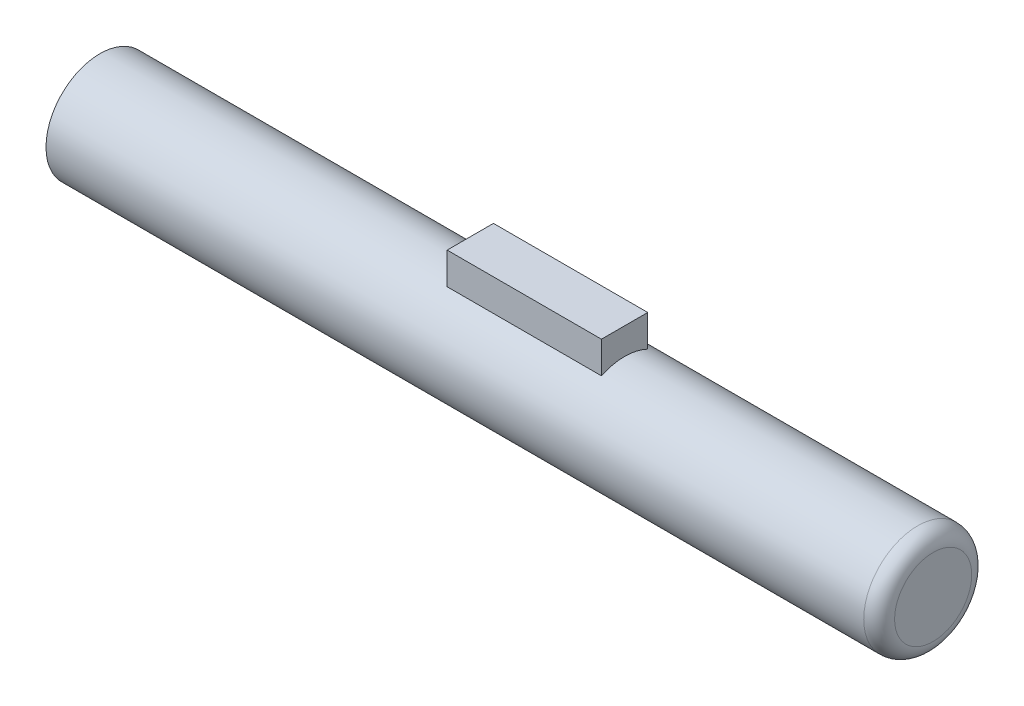
from build123d import *

# Parameters (mm, degrees)
IZIM1_W                     = 54
IZIM1_H                     = 3.5
Y_KSEKLIK_EKSTR_ZYON1_START = -30
Y_KSEKLIK_EKSTR_ZYON1_DEPTH = 10
RADYUS1_R                   = 1


with BuildPart() as part:
    # Çizim1 → Döndür1 (revolve)
    with BuildSketch(Plane.XY, mode=Mode.PRIVATE) as d_nd_r1_sk:
        with Locations((27, 1.75)):
            Rectangle(IZIM1_W, IZIM1_H)
    revolve(d_nd_r1_sk.sketch.rotate(Axis((0, 0, 0), (1, 0, 0)), 90), axis=Axis((0, 0, 0), (1, 0, 0)))

    # Çizim2 → Yükseklik-Ekstrüzyon1 (add)
    with BuildSketch(Plane(origin=(54, 0, 0), x_dir=(0, 0, -1), z_dir=(1, 0, 0)).offset(Y_KSEKLIK_EKSTR_ZYON1_START)):
        with BuildLine():
            Line((-1.5, 5.22), (1.5, 5.22))
            Line((1.5, 5.22), (1.5, 3.16227766))
            ThreePointArc((1.5, 3.16227766), (0, 3.5), (-1.5, 3.16227766))
            Line((-1.5, 3.16227766), (-1.5, 5.22))
        make_face()
    extrude(amount=Y_KSEKLIK_EKSTR_ZYON1_DEPTH)

    # Radyus1
    radyus1_edges = [part.edges().sort_by_distance(p)[0] for p in [
        (54, 0, -3.5),
    ]]
    fillet(radyus1_edges, radius=RADYUS1_R)


solid = part.part
